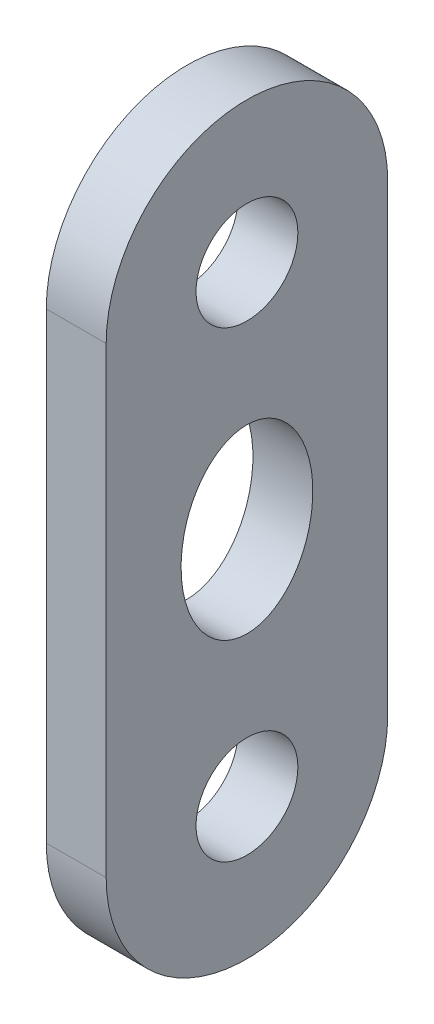
from build123d import *

# Parameters (mm, degrees)
SKETCH1_R           = 1.7
SKETCH1_RX          = 3.021964858
SKETCH1_RY          = 2.2
BOSS_EXTRUDE1_DEPTH = 2


with BuildPart() as part:
    # Sketch1 → Boss-Extrude1 (new body)
    with BuildSketch(Plane(origin=(0, 0, 0), x_dir=(0, 0, -1), z_dir=(1, 0, 0))):
        with BuildLine():
            Line((-4.7, -15.443929717), (-4.7, 0))
            ThreePointArc((-4.7, 0), (0, 4.7), (4.7, 0))
            Line((4.7, 0), (4.7, -15.443929717))
            ThreePointArc((4.7, -15.443929717), (0, -20.143929717), (-4.7, -15.443929717))
        make_face()
        Circle(SKETCH1_R, mode=Mode.SUBTRACT)
        with Locations((0, -15.443929717)):
            Circle(SKETCH1_R, mode=Mode.SUBTRACT)
        with Locations(Location((0, -7.721964858), (0, 0, -90))):
            Ellipse(SKETCH1_RX, SKETCH1_RY, mode=Mode.SUBTRACT)
    extrude(amount=BOSS_EXTRUDE1_DEPTH)


solid = part.part
